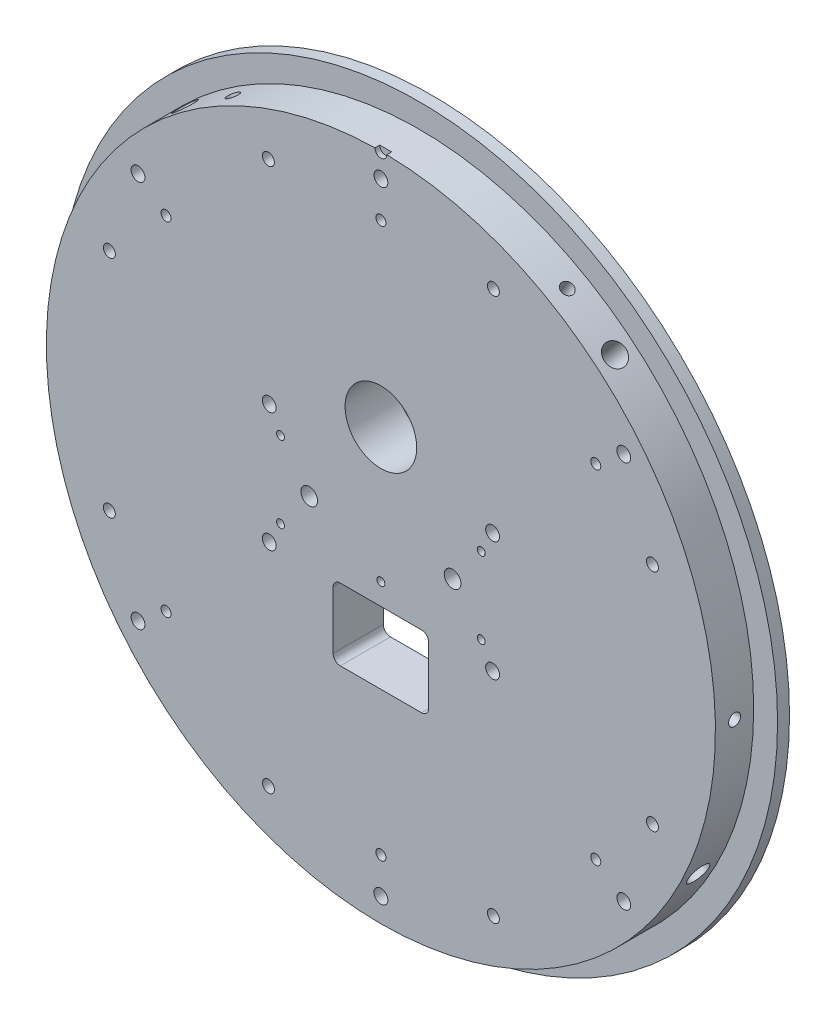
from build123d import *

# Parameters (mm, degrees)
SKETCH_1_R                   = 150
EXTRUDE_1_DEPTH              = 5
SKETCH_2_R                   = 140
EXTRUDE_2_DEPTH              = 16
SKETCH_3_R                   = 15
SKETCH_3_W                   = 40
SKETCH_3_H                   = 30
CUT_EXTRUDE_1_DEPTH          = 214.168947082
FILLET_2_R                   = 3
HOLE_WIZARD_M5_1_D           = 5.8
HOLE_WIZARD_M5_1_CBORE_D     = 10
HOLE_WIZARD_M5_1_CBORE_DEPTH = 8
HOLE_WIZARD_M6_1_D           = 7
HOLE_WIZARD_M6_1_CBORE_D     = 11
HOLE_WIZARD_M6_1_CBORE_DEPTH = 9
HOLE_WIZARD_M5_2_D           = 5.8
HOLE_WIZARD_M5_2_CBORE_D     = 10
HOLE_WIZARD_M5_2_CBORE_DEPTH = 8
M4X0_7_1_D                   = 3.3
M6X1_0_1_D                   = 5
PATTERN_CIRCULAR_1_COUNT     = 8
SKETCH_14_R                  = 2.5
CUT_EXTRUDE_2_DEPTH          = 2
M5X0_8_1_D                   = 4.2
PATTERN_CIRCULAR_2_COUNT     = 6
M10X1_0_1_D                  = 9
M10X1_0_1_DEPTH              = 25
M10X1_0_1_TIP                = 2.703872786
M10X1_0_1_ON_FACE_2_D        = 9
M10X1_0_1_ON_FACE_2_DEPTH    = 25
M10X1_0_1_ON_FACE_2_TIP      = 2.703872786
M10X1_0_1_ON_FACE_3_D        = 9
M10X1_0_1_ON_FACE_3_DEPTH    = 25
M10X1_0_1_ON_FACE_3_TIP      = 2.703872786
M10X1_0_1_ON_FACE_4_D        = 9
M10X1_0_1_ON_FACE_4_DEPTH    = 25
M10X1_0_1_ON_FACE_4_TIP      = 2.703872786


with BuildPart() as part:
    # ｽｹｯﾁ1 → ﾎﾞｽ - 押し出し1 (new body)
    with BuildSketch(Plane.XY):
        Circle(SKETCH_1_R)
    extrude(amount=EXTRUDE_1_DEPTH)

    # ｽｹｯﾁ2 → ﾎﾞｽ - 押し出し2 (add)
    with BuildSketch(Plane.XY.offset(5)):
        Circle(SKETCH_2_R)
    extrude(amount=EXTRUDE_2_DEPTH)

    # ｽｹｯﾁ3 → ｶｯﾄ - 押し出し1 (cut, through all)
    with BuildSketch(Plane(origin=(0, 0, 0), x_dir=(-1, 0, 0), z_dir=(0, 0, -1))):
        with Locations((0, 40)):
            Circle(SKETCH_3_R)
        with Locations((0, -40)):
            Rectangle(SKETCH_3_W, SKETCH_3_H)
    extrude(amount=-CUT_EXTRUDE_1_DEPTH, mode=Mode.SUBTRACT)

    # ﾌｨﾚｯﾄ2
    fillet_2_edges = [part.edges().sort_by_distance(p)[0] for p in [
        (-20, -25, 10.5),
        (-20, -55, 10.5),
        (20, -55, 10.5),
        (20, -25, 10.5),
    ]]
    fillet(fillet_2_edges, radius=FILLET_2_R)

    # M5 穴付きねじ用座ぐり穴1 (through all)
    with Locations(Plane(origin=(0, 130, 0), x_dir=(-1, 0, 0), z_dir=(0, 0, -1))):
        with Locations((0, 0), (101.640113623, -48.948859954), (-101.640113623, -48.948859954), (-101.640113623, -211.051140046), (0, -260), (101.640113623, -211.051140046)):
            CounterBoreHole(HOLE_WIZARD_M5_1_D / 2, HOLE_WIZARD_M5_1_CBORE_D / 2, HOLE_WIZARD_M5_1_CBORE_DEPTH)

    # M6 穴付きねじ用座ぐり穴1 (through all)
    with Locations(Plane(origin=(30, 0, 0), x_dir=(-1, 0, 0), z_dir=(0, 0, -1))):
        with Locations((0, 0), (60, 0)):
            CounterBoreHole(HOLE_WIZARD_M6_1_D / 2, HOLE_WIZARD_M6_1_CBORE_D / 2, HOLE_WIZARD_M6_1_CBORE_DEPTH)

    # M5 穴付きねじ用座ぐり穴2 (through all)
    with Locations(Plane(origin=(46.733285782, 25, 0), x_dir=(-1, 0, 0), z_dir=(0, 0, -1))):
        with Locations((0, 0), (0, -50), (93.466571564, 0), (93.466571564, -50)):
            CounterBoreHole(HOLE_WIZARD_M5_2_D / 2, HOLE_WIZARD_M5_2_CBORE_D / 2, HOLE_WIZARD_M5_2_CBORE_DEPTH)

    # M4x0.7 ねじ穴1 (through all)
    with Locations(Plane(origin=(42, 16, 0), x_dir=(-1, 0, 0), z_dir=(0, 0, -1))):
        with Locations((0, 0), (84, 0), (84, -32), (42, -32), (0, -32)):
            Hole(M4X0_7_1_D / 2)

    # M6x1.0 ねじ穴1 (through all)
    with Locations(Plane(origin=(-113.637182499, 47.070062181, 0), x_dir=(-1, 0, 0), z_dir=(0, 0, -1))):
        with Locations((0, 0)):
            m6x1_0_1 = Hole(M6X1_0_1_D / 2)

    # 円形ﾊﾟﾀｰﾝ1: M6x1.0 ねじ穴1 ×8 about axis
    pattern_circular_1_axis = Axis((0, 0, 0), (0, 0, 1))
    for i in range(1, PATTERN_CIRCULAR_1_COUNT):
        add(m6x1_0_1.rotate(pattern_circular_1_axis, i * 360 / PATTERN_CIRCULAR_1_COUNT), mode=Mode.SUBTRACT)

    # ｽｹｯﾁ14 → ｶｯﾄ - 押し出し2 (cut)
    with BuildSketch(Plane(origin=(0, 0, 21), x_dir=(-1, 0, 0), z_dir=(0, 0, -1))):
        with Locations((0, 140)):
            Circle(SKETCH_14_R)
    extrude(amount=CUT_EXTRUDE_2_DEPTH, mode=Mode.SUBTRACT)

    # M5x0.8 ねじ穴1 (through all)
    with Locations(Plane(origin=(-89.912408205, 71.699085425, 0), x_dir=(-1, 0, 0), z_dir=(0, 0, -1))):
        with Locations((0, 0), (0, -143.39817085), (-89.912408205, -186.699085425), (-179.82481641, -143.39817085), (-179.82481641, 0), (-89.912408205, 43.300914575)):
            Hole(M5X0_8_1_D / 2)

    # ｽｹｯﾁ19 → M6x1.0 ねじ穴2 (revolve, cut)
    with BuildSketch(Plane(origin=(140, 0, 13), x_dir=(0, 0, -1), z_dir=(0, 1, 0))):
        Polygon((0, 0), (0, 21.502151548), (2.5, 20), (2.5, 0), align=None)
    m6x1_0_2 = revolve(axis=Axis((146.35, 0, 13), (-1, 0, 0)), mode=Mode.SUBTRACT)

    # 円形ﾊﾟﾀｰﾝ2: M6x1.0 ねじ穴2 ×6 about axis
    pattern_circular_2_axis = Axis((0, 0, -1.05), (0, 0, 1))
    for i in range(1, PATTERN_CIRCULAR_2_COUNT):
        add(m6x1_0_2.rotate(pattern_circular_2_axis, i * 360 / PATTERN_CIRCULAR_2_COUNT), mode=Mode.SUBTRACT)

    # M10x1.0 ねじ穴1
    with Locations(Plane(origin=(-89.990265356, 107.246222037, 13), x_dir=(0.766044443119, 0.642787609687, 0), z_dir=(-0.642787609687, 0.766044443119, 0))):
        with Locations((0, 0)):
            Hole(M10X1_0_1_D / 2, depth=M10X1_0_1_DEPTH)
            with Locations((0, 0, -(M10X1_0_1_DEPTH + M10X1_0_1_TIP / 2))):  # 118° drill point
                Cone(0, M10X1_0_1_D / 2, M10X1_0_1_TIP, mode=Mode.SUBTRACT)

    # M10x1.0 ねじ穴1 on face 2
    with Locations(Plane(origin=(89.990265356, 107.246222037, 13), x_dir=(0.766044067841, -0.642788056925, 0), z_dir=(0.642788056925, 0.766044067841, 0))):
        with Locations((0, 0)):
            Hole(M10X1_0_1_ON_FACE_2_D / 2, depth=M10X1_0_1_ON_FACE_2_DEPTH)
            with Locations((0, 0, -(M10X1_0_1_ON_FACE_2_DEPTH + M10X1_0_1_ON_FACE_2_TIP / 2))):  # 118° drill point
                Cone(0, M10X1_0_1_ON_FACE_2_D / 2, M10X1_0_1_ON_FACE_2_TIP, mode=Mode.SUBTRACT)

    # M10x1.0 ねじ穴1 on face 3
    with Locations(Plane(origin=(124.740913386, -63.558669964, 13), x_dir=(0.45398991053, 0.891006824405, 0), z_dir=(0.891006824405, -0.45398991053, 0))):
        with Locations((1e-09, 0)):
            Hole(M10X1_0_1_ON_FACE_3_D / 2, depth=M10X1_0_1_ON_FACE_3_DEPTH)
            with Locations((0, 0, -(M10X1_0_1_ON_FACE_3_DEPTH + M10X1_0_1_ON_FACE_3_TIP / 2))):  # 118° drill point
                Cone(0, M10X1_0_1_ON_FACE_3_D / 2, M10X1_0_1_ON_FACE_3_TIP, mode=Mode.SUBTRACT)

    # M10x1.0 ねじ穴1 on face 4
    with Locations(Plane(origin=(-89.990265356, -107.246222037, 13), x_dir=(-0.766044067841, 0.642788056925, 0), z_dir=(-0.642788056925, -0.766044067841, 0))):
        with Locations((0, 0)):
            Hole(M10X1_0_1_ON_FACE_4_D / 2, depth=M10X1_0_1_ON_FACE_4_DEPTH)
            with Locations((0, 0, -(M10X1_0_1_ON_FACE_4_DEPTH + M10X1_0_1_ON_FACE_4_TIP / 2))):  # 118° drill point
                Cone(0, M10X1_0_1_ON_FACE_4_D / 2, M10X1_0_1_ON_FACE_4_TIP, mode=Mode.SUBTRACT)


solid = part.part
